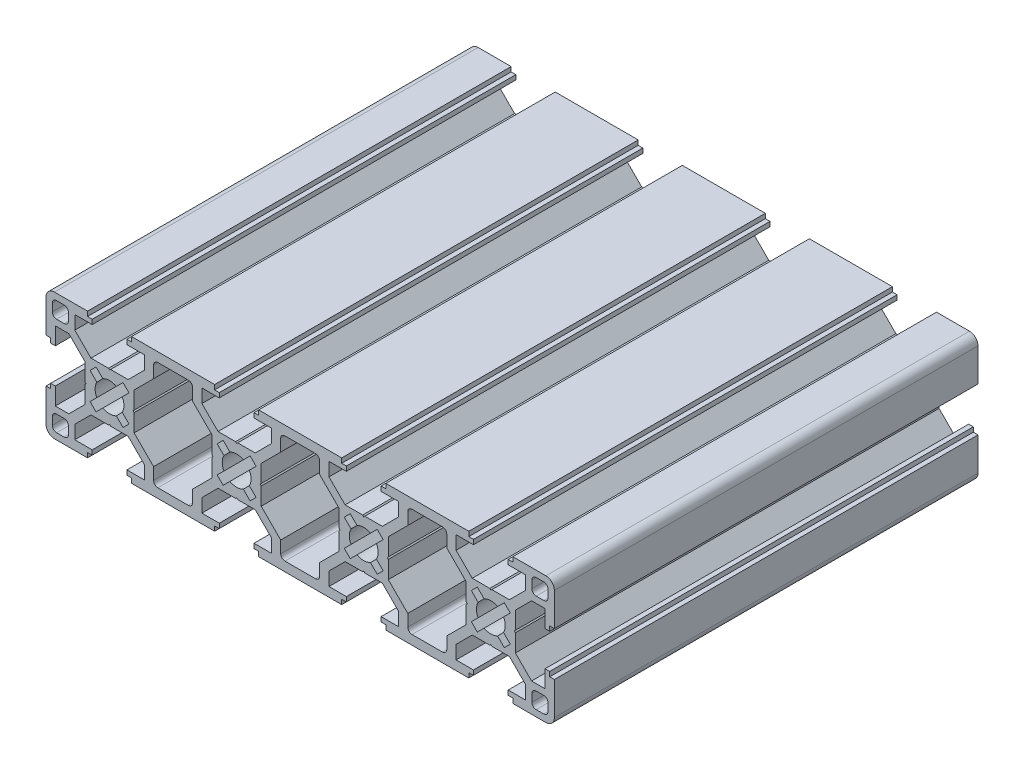
from build123d import *

# Parameters (mm, degrees)
BOSS_EXTRUDE1_DEPTH = 50


with BuildPart() as part:
    # Sketch1 → Boss-Extrude1 (new, symmetric)
    with BuildSketch(Plane.XY):
        with BuildLine():
            Line((-9.8, -15), (9.8, -15))
            Line((9.8, -15), (9.8, -13.9))
            Line((9.8, -13.9), (10.9, -13.9))
            Line((10.9, -13.9), (10.9, -12.8))
            Line((10.9, -12.8), (6.8, -12.8))
            Line((6.8, -12.8), (6.8, -9.614213562))
            Line((6.8, -9.614213562), (10.614213562, -5.8))
            Line((10.614213562, -5.8), (14.75, -5.8))
            Line((14.75, -5.8), (15, -5.55))
            Line((15, -5.55), (15.25, -5.8))
            Line((15.25, -5.8), (19.385786438, -5.8))
            Line((19.385786438, -5.8), (23.2, -9.614213562))
            Line((23.2, -9.614213562), (23.2, -12.8))
            Line((23.2, -12.8), (19.1, -12.8))
            Line((19.1, -12.8), (19.1, -13.9))
            Line((19.1, -13.9), (20.2, -13.9))
            Line((20.2, -13.9), (20.2, -15))
            Line((20.2, -15), (39.8, -15))
            Line((39.8, -15), (39.8, -13.9))
            Line((39.8, -13.9), (40.9, -13.9))
            Line((40.9, -13.9), (40.9, -12.8))
            Line((40.9, -12.8), (36.8, -12.8))
            Line((36.8, -12.8), (36.8, -9.614213562))
            Line((36.8, -9.614213562), (40.614213562, -5.8))
            Line((40.614213562, -5.8), (44.75, -5.8))
            Line((44.75, -5.8), (45, -5.55))
            Line((45, -5.55), (45.25, -5.8))
            Line((45.25, -5.8), (49.385786438, -5.8))
            Line((49.385786438, -5.8), (53.2, -9.614213562))
            Line((53.2, -9.614213562), (53.2, -12.8))
            Line((53.2, -12.8), (49.1, -12.8))
            Line((49.1, -12.8), (49.1, -13.9))
            Line((49.1, -13.9), (50.2, -13.9))
            Line((50.2, -13.9), (50.2, -15))
            Line((50.2, -15), (58, -15))
            ThreePointArc((58, -15), (59.414213562, -14.414213562), (60, -13))
            Line((60, -13), (60, -5.2))
            Line((60, -5.2), (58.9, -5.2))
            Line((58.9, -5.2), (58.9, -4.1))
            Line((58.9, -4.1), (57.8, -4.1))
            Line((57.8, -4.1), (57.8, -8.2))
            Line((57.8, -8.2), (54.614213562, -8.2))
            Line((54.614213562, -8.2), (50.8, -4.385786438))
            Line((50.8, -4.385786438), (50.8, -0.25))
            Line((50.8, -0.25), (50.55, 0))
            Line((50.55, 0), (50.8, 0.25))
            Line((50.8, 0.25), (50.8, 4.385786438))
            Line((50.8, 4.385786438), (54.614213562, 8.2))
            Line((54.614213562, 8.2), (57.8, 8.2))
            Line((57.8, 8.2), (57.8, 4.1))
            Line((57.8, 4.1), (58.9, 4.1))
            Line((58.9, 4.1), (58.9, 5.2))
            Line((58.9, 5.2), (60, 5.2))
            Line((60, 5.2), (60, 13))
            ThreePointArc((60, 13), (59.414213562, 14.414213562), (58, 15))
            Line((58, 15), (50.2, 15))
            Line((50.2, 15), (50.2, 13.9))
            Line((50.2, 13.9), (49.1, 13.9))
            Line((49.1, 13.9), (49.1, 12.8))
            Line((49.1, 12.8), (53.2, 12.8))
            Line((53.2, 12.8), (53.2, 9.614213562))
            Line((53.2, 9.614213562), (49.385786438, 5.8))
            Line((49.385786438, 5.8), (45.25, 5.8))
            Line((45.25, 5.8), (45, 5.55))
            Line((45, 5.55), (44.75, 5.8))
            Line((44.75, 5.8), (40.614213562, 5.8))
            Line((40.614213562, 5.8), (36.8, 9.614213562))
            Line((36.8, 9.614213562), (36.8, 12.8))
            Line((36.8, 12.8), (40.9, 12.8))
            Line((40.9, 12.8), (40.9, 13.9))
            Line((40.9, 13.9), (39.8, 13.9))
            Line((39.8, 13.9), (39.8, 15))
            Line((39.8, 15), (20.2, 15))
            Line((20.2, 15), (20.2, 13.9))
            Line((20.2, 13.9), (19.1, 13.9))
            Line((19.1, 13.9), (19.1, 12.8))
            Line((19.1, 12.8), (23.2, 12.8))
            Line((23.2, 12.8), (23.2, 9.614213562))
            Line((23.2, 9.614213562), (19.385786438, 5.8))
            Line((19.385786438, 5.8), (15.25, 5.8))
            Line((15.25, 5.8), (15, 5.55))
            Line((15, 5.55), (14.75, 5.8))
            Line((14.75, 5.8), (10.614213562, 5.8))
            Line((10.614213562, 5.8), (6.8, 9.614213562))
            Line((6.8, 9.614213562), (6.8, 12.8))
            Line((6.8, 12.8), (10.9, 12.8))
            Line((10.9, 12.8), (10.9, 13.9))
            Line((10.9, 13.9), (9.8, 13.9))
            Line((9.8, 13.9), (9.8, 15))
            Line((9.8, 15), (-9.8, 15))
            Line((-9.8, 15), (-9.8, 13.9))
            Line((-9.8, 13.9), (-10.9, 13.9))
            Line((-10.9, 13.9), (-10.9, 12.8))
            Line((-10.9, 12.8), (-6.8, 12.8))
            Line((-6.8, 12.8), (-6.8, 9.614213562))
            Line((-6.8, 9.614213562), (-10.614213562, 5.8))
            Line((-10.614213562, 5.8), (-14.75, 5.8))
            Line((-14.75, 5.8), (-15, 5.55))
            Line((-15, 5.55), (-15.25, 5.8))
            Line((-15.25, 5.8), (-19.385786438, 5.8))
            Line((-19.385786438, 5.8), (-23.2, 9.614213562))
            Line((-23.2, 9.614213562), (-23.2, 12.8))
            Line((-23.2, 12.8), (-19.1, 12.8))
            Line((-19.1, 12.8), (-19.1, 13.9))
            Line((-19.1, 13.9), (-20.2, 13.9))
            Line((-20.2, 13.9), (-20.2, 15))
            Line((-20.2, 15), (-39.8, 15))
            Line((-39.8, 15), (-39.8, 13.9))
            Line((-39.8, 13.9), (-40.9, 13.9))
            Line((-40.9, 13.9), (-40.9, 12.8))
            Line((-40.9, 12.8), (-36.8, 12.8))
            Line((-36.8, 12.8), (-36.8, 9.614213562))
            Line((-36.8, 9.614213562), (-40.614213562, 5.8))
            Line((-40.614213562, 5.8), (-44.75, 5.8))
            Line((-44.75, 5.8), (-45, 5.55))
            Line((-45, 5.55), (-45.25, 5.8))
            Line((-45.25, 5.8), (-49.385786438, 5.8))
            Line((-49.385786438, 5.8), (-53.2, 9.614213562))
            Line((-53.2, 9.614213562), (-53.2, 12.8))
            Line((-53.2, 12.8), (-49.1, 12.8))
            Line((-49.1, 12.8), (-49.1, 13.9))
            Line((-49.1, 13.9), (-50.2, 13.9))
            Line((-50.2, 13.9), (-50.2, 15))
            Line((-50.2, 15), (-58, 15))
            ThreePointArc((-58, 15), (-59.414213562, 14.414213562), (-60, 13))
            Line((-60, 13), (-60, 5.2))
            Line((-60, 5.2), (-58.9, 5.2))
            Line((-58.9, 5.2), (-58.9, 4.1))
            Line((-58.9, 4.1), (-57.8, 4.1))
            Line((-57.8, 4.1), (-57.8, 8.2))
            Line((-57.8, 8.2), (-54.614213562, 8.2))
            Line((-54.614213562, 8.2), (-50.8, 4.385786438))
            Line((-50.8, 4.385786438), (-50.8, 0.25))
            Line((-50.8, 0.25), (-50.55, 0))
            Line((-50.55, 0), (-50.8, -0.25))
            Line((-50.8, -0.25), (-50.8, -4.385786438))
            Line((-50.8, -4.385786438), (-54.614213562, -8.2))
            Line((-54.614213562, -8.2), (-57.8, -8.2))
            Line((-57.8, -8.2), (-57.8, -4.1))
            Line((-57.8, -4.1), (-58.9, -4.1))
            Line((-58.9, -4.1), (-58.9, -5.2))
            Line((-58.9, -5.2), (-60, -5.2))
            Line((-60, -5.2), (-60, -13))
            ThreePointArc((-60, -13), (-59.414213562, -14.414213562), (-58, -15))
            Line((-58, -15), (-50.2, -15))
            Line((-50.2, -15), (-50.2, -13.9))
            Line((-50.2, -13.9), (-49.1, -13.9))
            Line((-49.1, -13.9), (-49.1, -12.8))
            Line((-49.1, -12.8), (-53.2, -12.8))
            Line((-53.2, -12.8), (-53.2, -9.614213562))
            Line((-53.2, -9.614213562), (-49.385786438, -5.8))
            Line((-49.385786438, -5.8), (-45.25, -5.8))
            Line((-45.25, -5.8), (-45, -5.55))
            Line((-45, -5.55), (-44.75, -5.8))
            Line((-44.75, -5.8), (-40.614213562, -5.8))
            Line((-40.614213562, -5.8), (-36.8, -9.614213562))
            Line((-36.8, -9.614213562), (-36.8, -12.8))
            Line((-36.8, -12.8), (-40.9, -12.8))
            Line((-40.9, -12.8), (-40.9, -13.9))
            Line((-40.9, -13.9), (-39.8, -13.9))
            Line((-39.8, -13.9), (-39.8, -15))
            Line((-39.8, -15), (-20.2, -15))
            Line((-20.2, -15), (-20.2, -13.9))
            Line((-20.2, -13.9), (-19.1, -13.9))
            Line((-19.1, -13.9), (-19.1, -12.8))
            Line((-19.1, -12.8), (-23.2, -12.8))
            Line((-23.2, -12.8), (-23.2, -9.614213562))
            Line((-23.2, -9.614213562), (-19.385786438, -5.8))
            Line((-19.385786438, -5.8), (-15.25, -5.8))
            Line((-15.25, -5.8), (-15, -5.55))
            Line((-15, -5.55), (-14.75, -5.8))
            Line((-14.75, -5.8), (-10.614213562, -5.8))
            Line((-10.614213562, -5.8), (-6.8, -9.614213562))
            Line((-6.8, -9.614213562), (-6.8, -12.8))
            Line((-6.8, -12.8), (-10.9, -12.8))
            Line((-10.9, -12.8), (-10.9, -13.9))
            Line((-10.9, -13.9), (-9.8, -13.9))
            Line((-9.8, -13.9), (-9.8, -15))
        make_face()
        with BuildLine():
            Line((-58.5, 10.7), (-58.5, 12.5))
            ThreePointArc((-58.5, 12.5), (-58.207106781, 13.207106781), (-57.5, 13.5))
            Line((-57.5, 13.5), (-55.7, 13.5))
            ThreePointArc((-55.7, 13.5), (-54.992893219, 13.207106781), (-54.7, 12.5))
            Line((-54.7, 12.5), (-54.7, 10.7))
            ThreePointArc((-54.7, 10.7), (-54.992893219, 9.992893219), (-55.7, 9.7))
            Line((-55.7, 9.7), (-57.5, 9.7))
            ThreePointArc((-57.5, 9.7), (-58.207106781, 9.992893219), (-58.5, 10.7))
        make_face(mode=Mode.SUBTRACT)
        with BuildLine():
            Line((-41.99506816, -1.590718277), (-40.404077903, -3.181708535))
            Line((-40.404077903, -3.181708535), (-41.818291465, -4.595922097))
            Line((-41.818291465, -4.595922097), (-43.409281723, -3.00493184))
            ThreePointArc((-43.409281723, -3.00493184), (-45, -3.4), (-46.590718277, -3.00493184))
            Line((-46.590718277, -3.00493184), (-48.181708535, -4.595922097))
            Line((-48.181708535, -4.595922097), (-49.595922097, -3.181708535))
            Line((-49.595922097, -3.181708535), (-48.00493184, -1.590718277))
            ThreePointArc((-48.00493184, -1.590718277), (-48.4, 0), (-48.00493184, 1.590718277))
            Line((-48.00493184, 1.590718277), (-49.595922097, 3.181708535))
            Line((-49.595922097, 3.181708535), (-48.181708535, 4.595922097))
            Line((-48.181708535, 4.595922097), (-46.590718277, 3.00493184))
            ThreePointArc((-46.590718277, 3.00493184), (-45, 3.4), (-43.409281723, 3.00493184))
            Line((-43.409281723, 3.00493184), (-41.818291465, 4.595922097))
            Line((-41.818291465, 4.595922097), (-40.404077903, 3.181708535))
            Line((-40.404077903, 3.181708535), (-41.99506816, 1.590718277))
            ThreePointArc((-41.99506816, 1.590718277), (-41.6, 0), (-41.99506816, -1.590718277))
        make_face(mode=Mode.SUBTRACT)
        with BuildLine():
            Line((-58.5, -12.5), (-58.5, -10.7))
            ThreePointArc((-58.5, -10.7), (-58.207106781, -9.992893219), (-57.5, -9.7))
            Line((-57.5, -9.7), (-55.7, -9.7))
            ThreePointArc((-55.7, -9.7), (-54.992893219, -9.992893219), (-54.7, -10.7))
            Line((-54.7, -10.7), (-54.7, -12.5))
            ThreePointArc((-54.7, -12.5), (-54.992893219, -13.207106781), (-55.7, -13.5))
            Line((-55.7, -13.5), (-57.5, -13.5))
            ThreePointArc((-57.5, -13.5), (-58.207106781, -13.207106781), (-58.5, -12.5))
        make_face(mode=Mode.SUBTRACT)
        with BuildLine():
            Line((-20.55, 0), (-20.8, -0.25))
            Line((-20.8, -0.25), (-20.8, -4.385786438))
            Line((-20.8, -4.385786438), (-25.4, -8.985786438))
            Line((-25.4, -8.985786438), (-25.4, -11.8))
            ThreePointArc((-25.4, -11.8), (-25.692893219, -12.507106781), (-26.4, -12.8))
            Line((-26.4, -12.8), (-33.6, -12.8))
            ThreePointArc((-33.6, -12.8), (-34.307106781, -12.507106781), (-34.6, -11.8))
            Line((-34.6, -11.8), (-34.6, -8.985786438))
            Line((-34.6, -8.985786438), (-39.2, -4.385786438))
            Line((-39.2, -4.385786438), (-39.2, -0.25))
            Line((-39.2, -0.25), (-39.45, 0))
            Line((-39.45, 0), (-39.2, 0.25))
            Line((-39.2, 0.25), (-39.2, 4.385786438))
            Line((-39.2, 4.385786438), (-34.6, 8.985786438))
            Line((-34.6, 8.985786438), (-34.6, 11.8))
            ThreePointArc((-34.6, 11.8), (-34.307106781, 12.507106781), (-33.6, 12.8))
            Line((-33.6, 12.8), (-26.4, 12.8))
            ThreePointArc((-26.4, 12.8), (-25.692893219, 12.507106781), (-25.4, 11.8))
            Line((-25.4, 11.8), (-25.4, 8.985786438))
            Line((-25.4, 8.985786438), (-20.8, 4.385786438))
            Line((-20.8, 4.385786438), (-20.8, 0.25))
            Line((-20.8, 0.25), (-20.55, 0))
        make_face(mode=Mode.SUBTRACT)
        with BuildLine():
            Line((-11.99506816, -1.590718277), (-10.404077903, -3.181708535))
            Line((-10.404077903, -3.181708535), (-11.818291465, -4.595922097))
            Line((-11.818291465, -4.595922097), (-13.409281723, -3.00493184))
            ThreePointArc((-13.409281723, -3.00493184), (-15, -3.4), (-16.590718277, -3.00493184))
            Line((-16.590718277, -3.00493184), (-18.181708535, -4.595922097))
            Line((-18.181708535, -4.595922097), (-19.595922097, -3.181708535))
            Line((-19.595922097, -3.181708535), (-18.00493184, -1.590718277))
            ThreePointArc((-18.00493184, -1.590718277), (-18.4, 0), (-18.00493184, 1.590718277))
            Line((-18.00493184, 1.590718277), (-19.595922097, 3.181708535))
            Line((-19.595922097, 3.181708535), (-18.181708535, 4.595922097))
            Line((-18.181708535, 4.595922097), (-16.590718277, 3.00493184))
            ThreePointArc((-16.590718277, 3.00493184), (-15, 3.4), (-13.409281723, 3.00493184))
            Line((-13.409281723, 3.00493184), (-11.818291465, 4.595922097))
            Line((-11.818291465, 4.595922097), (-10.404077903, 3.181708535))
            Line((-10.404077903, 3.181708535), (-11.99506816, 1.590718277))
            ThreePointArc((-11.99506816, 1.590718277), (-11.6, 0), (-11.99506816, -1.590718277))
        make_face(mode=Mode.SUBTRACT)
        with BuildLine():
            Line((11.99506816, 1.590718277), (10.404077903, 3.181708535))
            Line((10.404077903, 3.181708535), (11.818291465, 4.595922097))
            Line((11.818291465, 4.595922097), (13.409281723, 3.00493184))
            ThreePointArc((13.409281723, 3.00493184), (15, 3.4), (16.590718277, 3.00493184))
            Line((16.590718277, 3.00493184), (18.181708535, 4.595922097))
            Line((18.181708535, 4.595922097), (19.595922097, 3.181708535))
            Line((19.595922097, 3.181708535), (18.00493184, 1.590718277))
            ThreePointArc((18.00493184, 1.590718277), (18.4, 0), (18.00493184, -1.590718277))
            Line((18.00493184, -1.590718277), (19.595922097, -3.181708535))
            Line((19.595922097, -3.181708535), (18.181708535, -4.595922097))
            Line((18.181708535, -4.595922097), (16.590718277, -3.00493184))
            ThreePointArc((16.590718277, -3.00493184), (15, -3.4), (13.409281723, -3.00493184))
            Line((13.409281723, -3.00493184), (11.818291465, -4.595922097))
            Line((11.818291465, -4.595922097), (10.404077903, -3.181708535))
            Line((10.404077903, -3.181708535), (11.99506816, -1.590718277))
            ThreePointArc((11.99506816, -1.590718277), (11.6, 0), (11.99506816, 1.590718277))
        make_face(mode=Mode.SUBTRACT)
        with BuildLine():
            Line((20.8, -0.25), (20.55, 0))
            Line((20.55, 0), (20.8, 0.25))
            Line((20.8, 0.25), (20.8, 4.385786438))
            Line((20.8, 4.385786438), (25.4, 8.985786438))
            Line((25.4, 8.985786438), (25.4, 11.8))
            ThreePointArc((25.4, 11.8), (25.692893219, 12.507106781), (26.4, 12.8))
            Line((26.4, 12.8), (33.6, 12.8))
            ThreePointArc((33.6, 12.8), (34.307106781, 12.507106781), (34.6, 11.8))
            Line((34.6, 11.8), (34.6, 8.985786438))
            Line((34.6, 8.985786438), (39.2, 4.385786438))
            Line((39.2, 4.385786438), (39.2, 0.25))
            Line((39.2, 0.25), (39.45, 0))
            Line((39.45, 0), (39.2, -0.25))
            Line((39.2, -0.25), (39.2, -4.385786438))
            Line((39.2, -4.385786438), (34.6, -8.985786438))
            Line((34.6, -8.985786438), (34.6, -11.8))
            ThreePointArc((34.6, -11.8), (34.307106781, -12.507106781), (33.6, -12.8))
            Line((33.6, -12.8), (26.4, -12.8))
            ThreePointArc((26.4, -12.8), (25.692893219, -12.507106781), (25.4, -11.8))
            Line((25.4, -11.8), (25.4, -8.985786438))
            Line((25.4, -8.985786438), (20.8, -4.385786438))
            Line((20.8, -4.385786438), (20.8, -0.25))
        make_face(mode=Mode.SUBTRACT)
        with BuildLine():
            Line((58.5, -10.7), (58.5, -12.5))
            ThreePointArc((58.5, -12.5), (58.207106781, -13.207106781), (57.5, -13.5))
            Line((57.5, -13.5), (55.7, -13.5))
            ThreePointArc((55.7, -13.5), (54.992893219, -13.207106781), (54.7, -12.5))
            Line((54.7, -12.5), (54.7, -10.7))
            ThreePointArc((54.7, -10.7), (54.992893219, -9.992893219), (55.7, -9.7))
            Line((55.7, -9.7), (57.5, -9.7))
            ThreePointArc((57.5, -9.7), (58.207106781, -9.992893219), (58.5, -10.7))
        make_face(mode=Mode.SUBTRACT)
        with BuildLine():
            Line((41.99506816, 1.590718277), (40.404077903, 3.181708535))
            Line((40.404077903, 3.181708535), (41.818291465, 4.595922097))
            Line((41.818291465, 4.595922097), (43.409281723, 3.00493184))
            ThreePointArc((43.409281723, 3.00493184), (45, 3.4), (46.590718277, 3.00493184))
            Line((46.590718277, 3.00493184), (48.181708535, 4.595922097))
            Line((48.181708535, 4.595922097), (49.595922097, 3.181708535))
            Line((49.595922097, 3.181708535), (48.00493184, 1.590718277))
            ThreePointArc((48.00493184, 1.590718277), (48.4, 0), (48.00493184, -1.590718277))
            Line((48.00493184, -1.590718277), (49.595922097, -3.181708535))
            Line((49.595922097, -3.181708535), (48.181708535, -4.595922097))
            Line((48.181708535, -4.595922097), (46.590718277, -3.00493184))
            ThreePointArc((46.590718277, -3.00493184), (45, -3.4), (43.409281723, -3.00493184))
            Line((43.409281723, -3.00493184), (41.818291465, -4.595922097))
            Line((41.818291465, -4.595922097), (40.404077903, -3.181708535))
            Line((40.404077903, -3.181708535), (41.99506816, -1.590718277))
            ThreePointArc((41.99506816, -1.590718277), (41.6, 0), (41.99506816, 1.590718277))
        make_face(mode=Mode.SUBTRACT)
        with BuildLine():
            Line((58.5, 12.5), (58.5, 10.7))
            ThreePointArc((58.5, 10.7), (58.207106781, 9.992893219), (57.5, 9.7))
            Line((57.5, 9.7), (55.7, 9.7))
            ThreePointArc((55.7, 9.7), (54.992893219, 9.992893219), (54.7, 10.7))
            Line((54.7, 10.7), (54.7, 12.5))
            ThreePointArc((54.7, 12.5), (54.992893219, 13.207106781), (55.7, 13.5))
            Line((55.7, 13.5), (57.5, 13.5))
            ThreePointArc((57.5, 13.5), (58.207106781, 13.207106781), (58.5, 12.5))
        make_face(mode=Mode.SUBTRACT)
        with BuildLine():
            Line((3.6, -12.8), (-3.6, -12.8))
            ThreePointArc((-3.6, -12.8), (-4.307106781, -12.507106781), (-4.6, -11.8))
            Line((-4.6, -11.8), (-4.6, -8.985786438))
            Line((-4.6, -8.985786438), (-9.2, -4.385786438))
            Line((-9.2, -4.385786438), (-9.2, -0.25))
            Line((-9.2, -0.25), (-9.45, 0))
            Line((-9.45, 0), (-9.2, 0.25))
            Line((-9.2, 0.25), (-9.2, 4.385786438))
            Line((-9.2, 4.385786438), (-4.6, 8.985786438))
            Line((-4.6, 8.985786438), (-4.6, 11.8))
            ThreePointArc((-4.6, 11.8), (-4.307106781, 12.507106781), (-3.6, 12.8))
            Line((-3.6, 12.8), (3.6, 12.8))
            ThreePointArc((3.6, 12.8), (4.307106781, 12.507106781), (4.6, 11.8))
            Line((4.6, 11.8), (4.6, 8.985786438))
            Line((4.6, 8.985786438), (9.2, 4.385786438))
            Line((9.2, 4.385786438), (9.2, 0.25))
            Line((9.2, 0.25), (9.45, 0))
            Line((9.45, 0), (9.2, -0.25))
            Line((9.2, -0.25), (9.2, -4.385786438))
            Line((9.2, -4.385786438), (4.6, -8.985786438))
            Line((4.6, -8.985786438), (4.6, -11.8))
            ThreePointArc((4.6, -11.8), (4.307106781, -12.507106781), (3.6, -12.8))
        make_face(mode=Mode.SUBTRACT)
    extrude(amount=BOSS_EXTRUDE1_DEPTH, both=True)


solid = part.part
